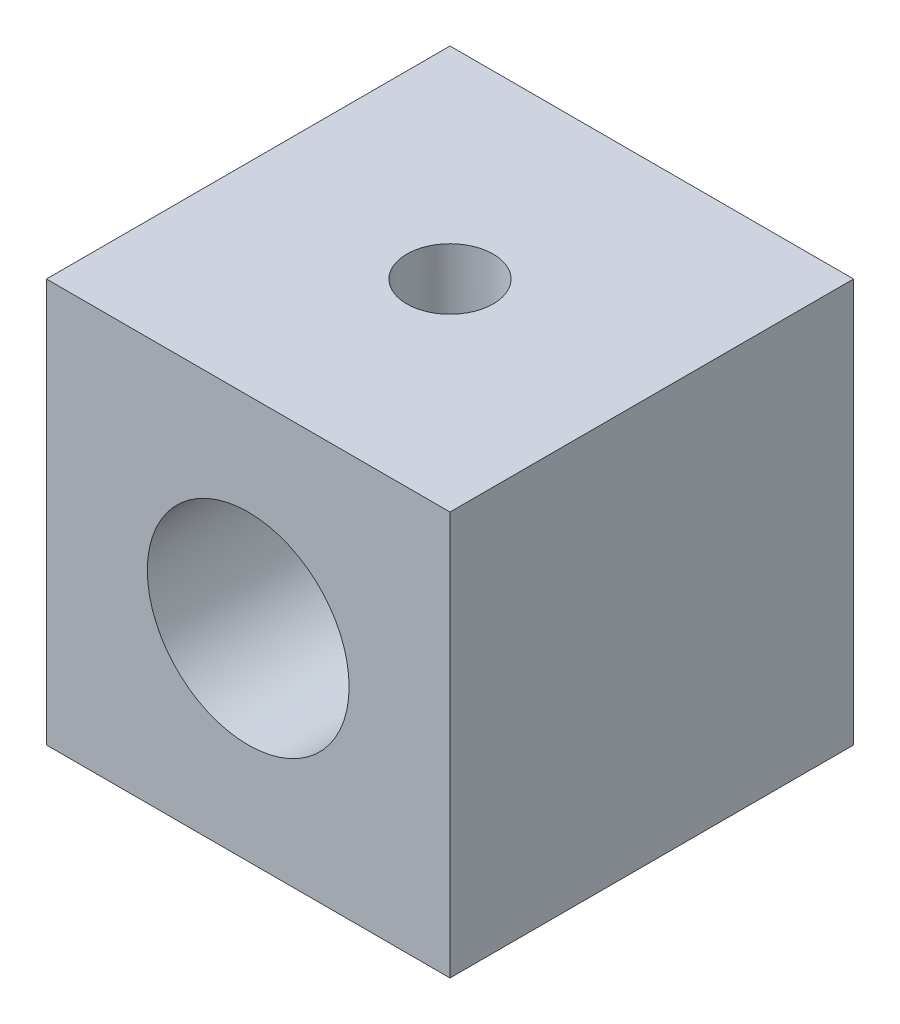
from build123d import *

# Parameters (mm, degrees)
CROQUIS1_W              = 40
CROQUIS1_H              = 40
CROQUIS1_R              = 10
SALIENTE_EXTRUIR1_DEPTH = 40
CROQUIS3_R              = 4.283553434
CORTAR_EXTRUIR1_DEPTH   = 61


with BuildPart() as part:
    # Croquis1 → Saliente-Extruir1 (new body)
    with BuildSketch(Plane.XY):
        Rectangle(CROQUIS1_W, CROQUIS1_H)
        Circle(CROQUIS1_R, mode=Mode.SUBTRACT)
    extrude(amount=SALIENTE_EXTRUIR1_DEPTH)

    # Croquis3 → Cortar-Extruir1 (cut, through all)
    with BuildSketch(Plane.XZ.offset(20)):
        with Locations((0, 20)):
            Circle(CROQUIS3_R)
    extrude(amount=-CORTAR_EXTRUIR1_DEPTH, mode=Mode.SUBTRACT)


solid = part.part
